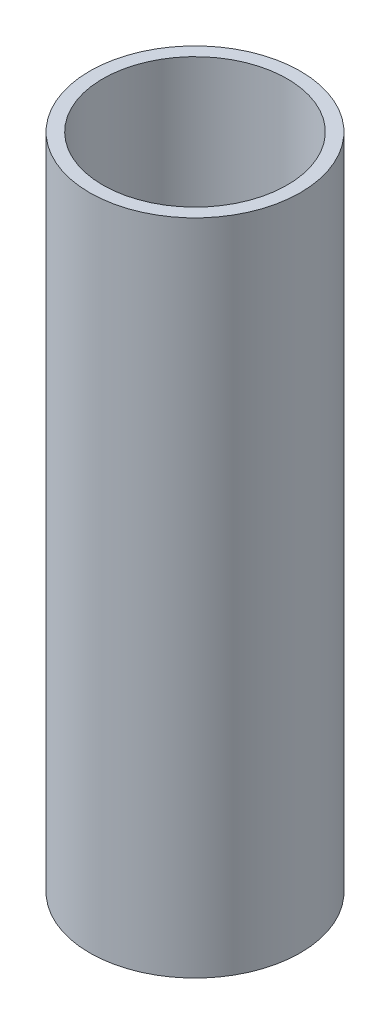
from build123d import *

# Parameters (mm, degrees)
SKETCH_1_R      = 8
SKETCH_1_R_2    = 7
EXTRUDE_1_DEPTH = 50


with BuildPart() as part:
    # Эскиз1 → Бобышка-Вытянуть1 (new body)
    with BuildSketch(Plane(origin=(0, 0, 0), x_dir=(1, 0, 0), z_dir=(0, 1, 0))):
        with Locations(Location((0, 0, 0), (0, 0, 270))):
            Circle(SKETCH_1_R)
        with Locations(Location((0, 0, 0), (0, 0, 270))):
            Circle(SKETCH_1_R_2, mode=Mode.SUBTRACT)
    extrude(amount=EXTRUDE_1_DEPTH)


solid = part.part
